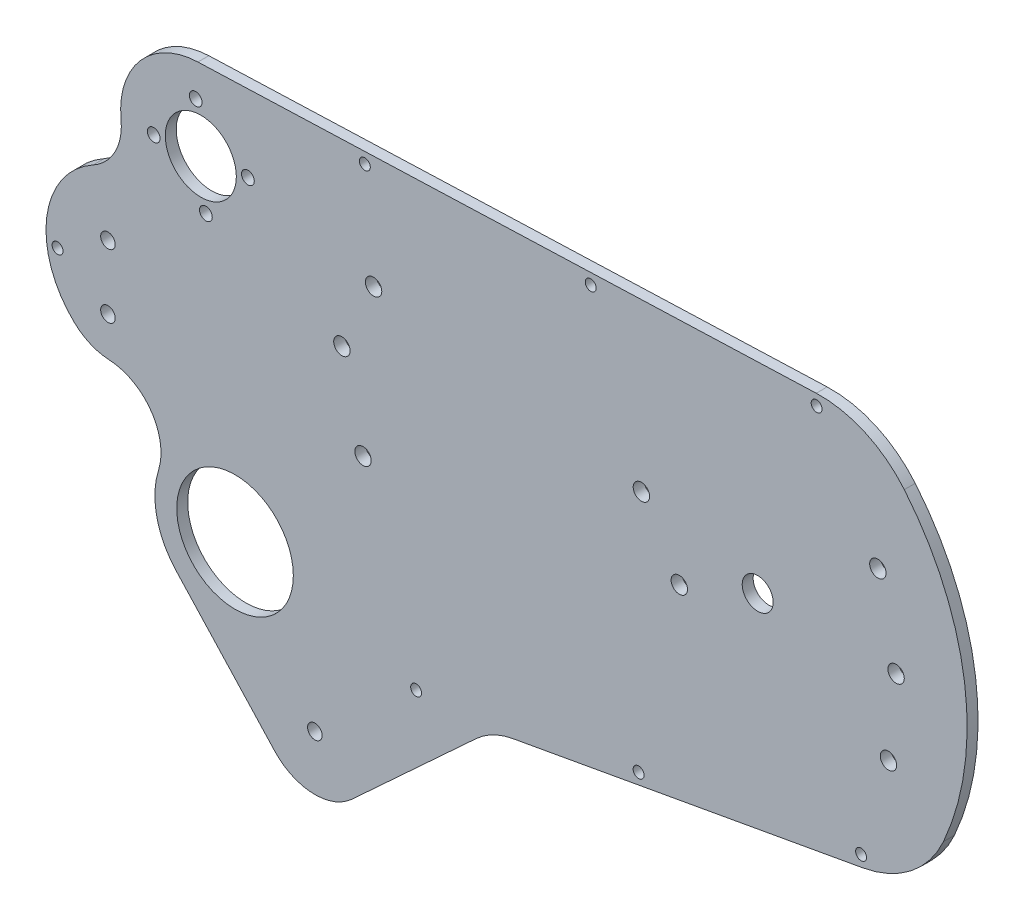
from build123d import *

# Parameters (mm, degrees)
SKETCH1_R           = 2
SKETCH1_R_2         = 16
SKETCH1_R_3         = 2.25
SKETCH1_R_4         = 4.25
SKETCH1_R_5         = 1.75
SKETCH1_R_6         = 9.75
BOSS_EXTRUDE1_DEPTH = 3
SKETCH2_R           = 1.5
CUT_EXTRUDE1_DEPTH  = 190.515777006


with BuildPart() as part:
    # Sketch1 → Boss-Extrude1 (new body)
    with BuildSketch(Plane.XY):
        with BuildLine():
            ThreePointArc((-137.970351553, -33.480224156), (-126.431132561, -39.888203569), (-124.422839539, -52.93360637))
            ThreePointArc((-124.422839539, -52.93360637), (-124.888175134, -64.31939994), (-119.594822483, -74.410646153))
            Line((-119.594822483, -74.410646153), (-92.540517723, -103.740413224))
            ThreePointArc((-92.540517723, -103.740413224), (-82.119700521, -108.557935129), (-71.344567605, -104.595807028))
            Line((-71.344567605, -104.595807028), (-37.221129556, -73.119733925))
            ThreePointArc((-37.221129556, -73.119733925), (-32.538343047, -69.892896145), (-27.140055215, -68.104192696))
            Line((-27.140055215, -68.104192696), (68.925058584, -50.795851294))
            ThreePointArc((68.925058584, -50.795851294), (82.107908339, -44.886103489), (91, -33.5))
            ThreePointArc((91, -33.5), (96.805715124, 7.17766304), (80.26119478, 44.789595257))
            ThreePointArc((80.26119478, 44.789595257), (69.434281248, 53.01522195), (56.08825014, 55.616461034))
            Line((56.08825014, 55.616461034), (-113.612396892, 49.485657177))
            ThreePointArc((-113.612396892, 49.485657177), (-129.404309407, 41.953313258), (-134.705774542, 25.279526249))
            ThreePointArc((-134.705774542, 25.279526249), (-136.343375771, 16.802270376), (-142.382746132, 10.632050724))
            ThreePointArc((-142.382746132, 10.632050724), (-155.099864059, -8.058287742), (-147.542861296, -29.364285714))
            ThreePointArc((-147.542861296, -29.364285714), (-143.125485566, -32.280163581), (-137.970351553, -33.480224156))
        make_face()
        with Locations((-81.514845762, -93.570135067)):
            Circle(SKETCH1_R, mode=Mode.SUBTRACT)
        with Locations((-103.42383694, -59.494238188)):
            Circle(SKETCH1_R_2, mode=Mode.SUBTRACT)
        with Locations((-138.3, -22.75)):
            Circle(SKETCH1_R, mode=Mode.SUBTRACT)
        with Locations((-138.3, -5.25)):
            Circle(SKETCH1_R, mode=Mode.SUBTRACT)
        with Locations((-68.3, -21.5)):
            Circle(SKETCH1_R_3, mode=Mode.SUBTRACT)
        with Locations((-74.1, 1.7)):
            Circle(SKETCH1_R_3, mode=Mode.SUBTRACT)
        with Locations((-65.4, 20.2)):
            Circle(SKETCH1_R_3, mode=Mode.SUBTRACT)
        with Locations((18.5, -8.7)):
            Circle(SKETCH1_R_3, mode=Mode.SUBTRACT)
        with Locations((8.1, 8.2)):
            Circle(SKETCH1_R_3, mode=Mode.SUBTRACT)
        with Locations((75.9, -21.8)):
            Circle(SKETCH1_R_3, mode=Mode.SUBTRACT)
        with Locations((40.017782272, 0)):
            Circle(SKETCH1_R_4, mode=Mode.SUBTRACT)
        with Locations((78, -0.1)):
            Circle(SKETCH1_R_3, mode=Mode.SUBTRACT)
        with Locations((73, 22.4)):
            Circle(SKETCH1_R_3, mode=Mode.SUBTRACT)
        with Locations((-114.213840088, 40.424858245)):
            Circle(SKETCH1_R_5, mode=Mode.SUBTRACT)
        with Locations((-111.422396488, 14.575141755)):
            Circle(SKETCH1_R_5, mode=Mode.SUBTRACT)
        with Locations((-125.742976533, 26.1042782)):
            Circle(SKETCH1_R_5, mode=Mode.SUBTRACT)
        with Locations((-112.818118288, 27.5)):
            Circle(SKETCH1_R_6, mode=Mode.SUBTRACT)
        with Locations((-99.893260043, 28.8957218)):
            Circle(SKETCH1_R_5, mode=Mode.SUBTRACT)
    extrude(amount=BOSS_EXTRUDE1_DEPTH)

    # Sketch2 → Cut-Extrude1 (cut, through all)
    with BuildSketch(Plane.XY.offset(3)):
        with Locations((56.196560986, 52.618416878)):
            Circle(SKETCH2_R)
        with Locations((-5.803439014, 50.378532436)):
            Circle(SKETCH2_R)
        with Locations((-67.803439014, 48.138647993)):
            Circle(SKETCH2_R)
        with Locations((68.393104802, -47.843390427)):
            Circle(SKETCH2_R)
        with Locations((7.335774003, -58.84427394)):
            Circle(SKETCH2_R)
        with Locations((-152.133709173, -14)):
            Circle(SKETCH2_R)
        with Locations((-53.721556796, -69.845157453)):
            Circle(SKETCH2_R)
    extrude(amount=-CUT_EXTRUDE1_DEPTH, mode=Mode.SUBTRACT)


solid = part.part
